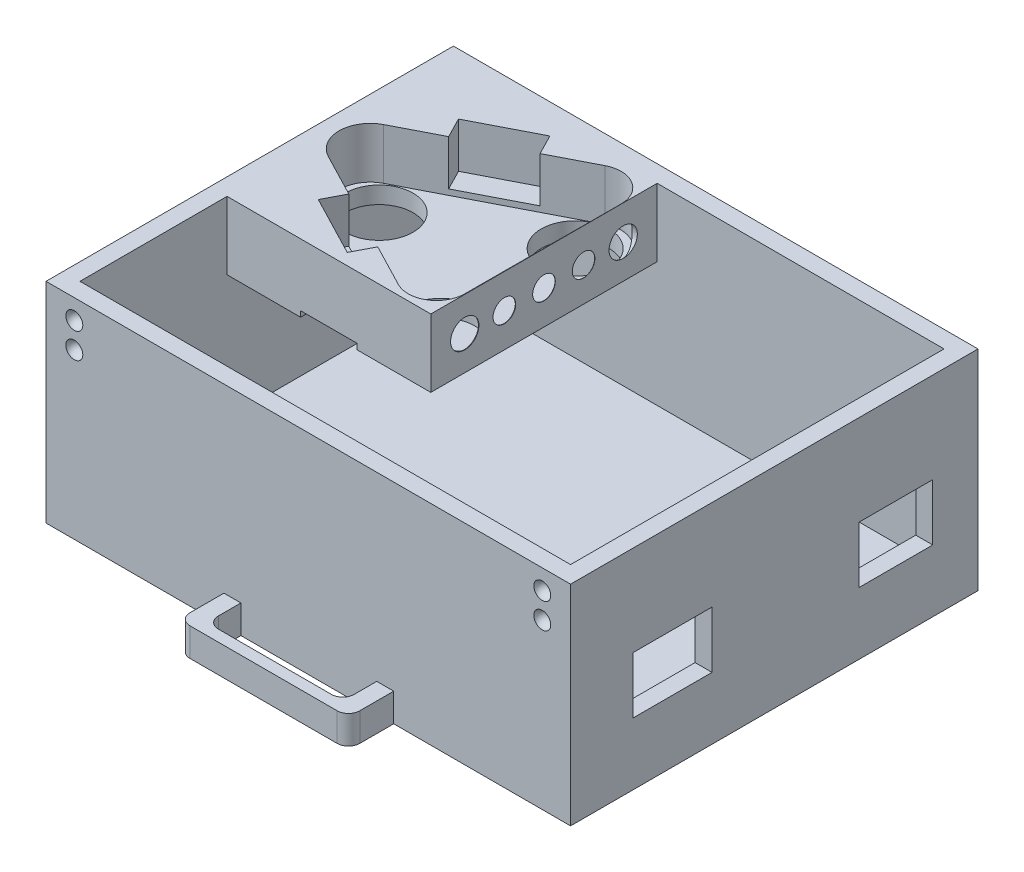
from build123d import *

# Parameters (mm, degrees)
SKETCH1_W           = 92.7
SKETCH1_H           = 37
BOSS_EXTRUDE1_DEPTH = 72
SKETCH3_W           = 86.7
SKETCH3_H           = 66
CUT_EXTRUDE1_DEPTH  = 34
SKETCH6_W           = 13
SKETCH6_H           = 10
SKETCH6_W_2         = 14
CUT_EXTRUDE2_DEPTH  = 3
SKETCH8_W           = 30
SKETCH8_H           = 5
BOSS_EXTRUDE2_DEPTH = 8
SKETCH9_W           = 24
SKETCH9_H           = 6
CUT_EXTRUDE3_DEPTH  = 8
FILLET3_R           = 2
FILLET4_R           = 2
SKETCH10_W          = 30
SKETCH10_H          = 5
BOSS_EXTRUDE3_DEPTH = 8
SKETCH11_W          = 24
SKETCH11_H          = 6
CUT_EXTRUDE4_DEPTH  = 8
FILLET5_R           = 2
BOSS_EXTRUDE4_DEPTH = 40
CUT_EXTRUDE5_DEPTH  = 9
SKETCH15_R          = 6
CUT_EXTRUDE6_DEPTH  = 12
CUT_EXTRUDE7_DEPTH  = 8
SKETCH26_R          = 2
SKETCH26_R_2        = 2.5
CUT_EXTRUDE8_DEPTH  = 1


with BuildPart() as part:
    # Sketch1 → Boss-Extrude1 (new body)
    with BuildSketch(Plane.XY):
        with Locations((46.35, 18.5)):
            Rectangle(SKETCH1_W, SKETCH1_H)
    extrude(amount=-BOSS_EXTRUDE1_DEPTH)

    # Sketch3 → Cut-Extrude1 (cut)
    with BuildSketch(Plane(origin=(0, 37, 0), x_dir=(1, 0, 0), z_dir=(0, 1, 0))):
        with Locations((46.35, 36)):
            Rectangle(SKETCH3_W, SKETCH3_H)
    extrude(amount=-CUT_EXTRUDE1_DEPTH, mode=Mode.SUBTRACT)

    # Sketch6 → Cut-Extrude2 (cut)
    with BuildSketch(Plane(origin=(92.7, 0, 0), x_dir=(0, 0, -1), z_dir=(1, 0, 0))):
        with Locations((57.5, 16)):
            Rectangle(SKETCH6_W, SKETCH6_H)
        with Locations((18, 16)):
            Rectangle(SKETCH6_W_2, SKETCH6_H)
    extrude(amount=-CUT_EXTRUDE2_DEPTH, mode=Mode.SUBTRACT)

    # Sketch8 → Boss-Extrude2 (add)
    with BuildSketch(Plane.XY):
        with Locations((46.447728755, 2.5)):
            Rectangle(SKETCH8_W, SKETCH8_H)
    extrude(amount=BOSS_EXTRUDE2_DEPTH)

    # Sketch9 → Cut-Extrude3 (cut)
    with BuildSketch(Plane(origin=(0, 5, 0), x_dir=(1, 0, 0), z_dir=(0, 1, 0))):
        with Locations((46.447728755, -3)):
            Rectangle(SKETCH9_W, SKETCH9_H)
    extrude(amount=-CUT_EXTRUDE3_DEPTH, mode=Mode.SUBTRACT)

    # Fillet3
    fillet3_edges = [part.edges().sort_by_distance(p)[0] for p in [
        (31.447728755, 2.5, 8),
        (61.447728755, 2.5, 8),
    ]]
    fillet(fillet3_edges, radius=FILLET3_R)

    # Fillet4
    fillet4_edges = [part.edges().sort_by_distance(p)[0] for p in [
        (58.447728755, 2.5, 6),
        (34.447728755, 2.5, 6),
    ]]
    fillet(fillet4_edges, radius=FILLET4_R)

    # Sketch10 → Boss-Extrude3 (add)
    with BuildSketch(Plane(origin=(0, 0, -72), x_dir=(-1, 0, 0), z_dir=(0, 0, -1))):
        with Locations((-46.35, 2.5)):
            Rectangle(SKETCH10_W, SKETCH10_H)
    extrude(amount=BOSS_EXTRUDE3_DEPTH)

    # Sketch11 → Cut-Extrude4 (cut)
    with BuildSketch(Plane(origin=(0, 5, 0), x_dir=(1, 0, 0), z_dir=(0, 1, 0))):
        with Locations((46.35, 75)):
            Rectangle(SKETCH11_W, SKETCH11_H)
    extrude(amount=-CUT_EXTRUDE4_DEPTH, mode=Mode.SUBTRACT)

    # Fillet5
    fillet5_edges = [part.edges().sort_by_distance(p)[0] for p in [
        (34.35, 2.5, -78),
        (58.35, 2.5, -78),
        (61.35, 2.5, -80),
        (31.35, 2.5, -80),
    ]]
    fillet(fillet5_edges, radius=FILLET5_R)

    # Sketch13 → Boss-Extrude4 (add)
    with BuildSketch(Plane.XY.offset(-69)):
        Polygon((3, 37), (3, 25), (16, 25), (16, 26), (26, 26), (26, 25), (39, 25), (39, 37), align=None)
    extrude(amount=BOSS_EXTRUDE4_DEPTH)

    # Sketch14 → Cut-Extrude5 (cut)
    with BuildSketch(Plane(origin=(0, 37, 0), x_dir=(1, 0, 0), z_dir=(0, 1, 0))):
        with BuildLine():
            Line((31.604139479, 30.654513564), (5.825726754, 44.05502325))
            ThreePointArc((5.825726754, 44.05502325), (2.862548541, 48.948836401), (5.850230218, 53.827728742))
            Line((5.850230218, 53.827728742), (31.695517579, 67.098800427))
            ThreePointArc((31.695517579, 67.098800427), (36.590581321, 66.914928251), (38.979411894, 62.638370465))
            Line((38.979411894, 62.638370465), (38.91030967, 35.078361321))
            ThreePointArc((38.91030967, 35.078361321), (36.500063726, 30.813836436), (31.604139479, 30.654513564))
        make_face()
    extrude(amount=-CUT_EXTRUDE5_DEPTH, mode=Mode.SUBTRACT)

    # Sketch15 → Cut-Extrude6 (cut)
    with BuildSketch(Plane(origin=(0, 28, 0), x_dir=(1, 0, 0), z_dir=(0, 1, 0))):
        with Locations((32.730960784, 37.059306593)):
            Circle(SKETCH15_R)
        with Locations((32.730960784, 60.777824087)):
            Circle(SKETCH15_R)
        with Locations((9.931562791, 48.935046092)):
            Circle(SKETCH15_R)
    extrude(amount=-CUT_EXTRUDE6_DEPTH, mode=Mode.SUBTRACT)

    # Sketch17 → Cut-Extrude7 (cut)
    with BuildSketch(Plane(origin=(0, 37, 0), x_dir=(1, 0, 0), z_dir=(0, 1, 0))):
        Polygon((18.772873899, 60.463264585), (24.11034588, 63.203956622), (22.283217855, 66.762271277), (11.608273892, 61.280887201), (13.435401917, 57.722572547), align=None)
        Polygon((18.714933117, 37.354768407), (24.038594399, 34.587345318), (22.193645673, 31.038237797), (11.546323109, 36.573083975), (13.391271835, 40.122191496), align=None)
    extrude(amount=-CUT_EXTRUDE7_DEPTH, mode=Mode.SUBTRACT)

    # Sketch20 → Cut-Revolve1 (revolve, cut)
    with BuildSketch(Plane.XY):
        with BuildLine():
            ThreePointArc((5, 35), (3.5, 33.5), (5, 32))
            Line((5, 32), (5, 35))
        make_face()
        with BuildLine():
            Line((5, 27.5), (5, 30.5))
            ThreePointArc((5, 30.5), (3.5, 29), (5, 27.5))
        make_face()
    revolve(axis=Axis((5, 32, 0), (0, 1, 0)), mode=Mode.SUBTRACT)

    # Sketch22 → Cut-Revolve2 (revolve, cut)
    with BuildSketch(Plane.XY):
        with BuildLine():
            Line((87.7, 35), (87.7, 32))
            ThreePointArc((87.7, 32), (86.2, 33.5), (87.7, 35))
        make_face()
        with BuildLine():
            Line((87.7, 30.5), (87.7, 27.5))
            ThreePointArc((87.7, 27.5), (86.2, 29), (87.7, 30.5))
        make_face()
    revolve(axis=Axis((87.7, 35, 0), (0, -1, 0)), mode=Mode.SUBTRACT)

    # Sketch23 → Cut-Revolve8 (revolve, cut)
    with BuildSketch(Plane(origin=(0, 0, -72), x_dir=(-1, 0, 0), z_dir=(0, 0, -1))):
        with BuildLine():
            Line((-87.7, 35), (-87.7, 32))
            ThreePointArc((-87.7, 32), (-89.2, 33.5), (-87.7, 35))
        make_face()
        with BuildLine():
            Line((-87.7, 30.5), (-87.7, 27.5))
            ThreePointArc((-87.7, 27.5), (-89.2, 29), (-87.7, 30.5))
        make_face()
    revolve(axis=Axis((87.7, 35, -72), (0, -1, 0)), mode=Mode.SUBTRACT)

    # Sketch24 → Cut-Revolve9 (revolve, cut)
    with BuildSketch(Plane(origin=(0, 0, -72), x_dir=(-1, 0, 0), z_dir=(0, 0, -1))):
        with BuildLine():
            Line((-5, 35), (-5, 32))
            ThreePointArc((-5, 32), (-6.5, 33.5), (-5, 35))
        make_face()
        with BuildLine():
            Line((-5, 27.5), (-5, 30.5))
            ThreePointArc((-5, 30.5), (-6.5, 29), (-5, 27.5))
        make_face()
    revolve(axis=Axis((5, 35, -72), (0, -1, 0)), mode=Mode.SUBTRACT)

    # Sketch26 → Cut-Extrude8 (cut)
    with BuildSketch(Plane(origin=(39, 0, 0), x_dir=(0, 0, -1), z_dir=(1, 0, 0))):
        with Locations((49, 31)):
            Circle(SKETCH26_R)
        with Locations((56, 31)):
            Circle(SKETCH26_R)
        with Locations((42, 31)):
            Circle(SKETCH26_R)
        with Locations((35, 31)):
            Circle(SKETCH26_R_2)
        with Locations((63, 31)):
            Circle(SKETCH26_R_2)
    extrude(amount=-CUT_EXTRUDE8_DEPTH, mode=Mode.SUBTRACT)


solid = part.part
